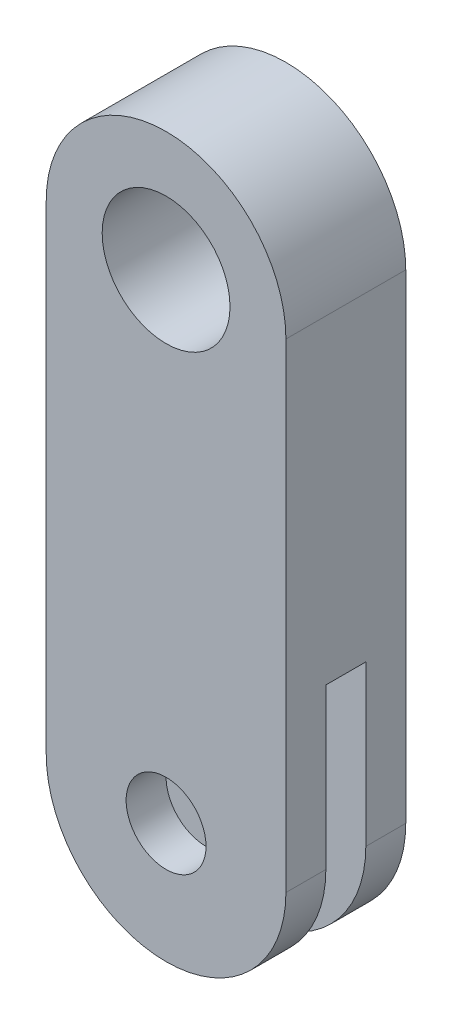
from build123d import *
from build123d.topology import SkipClean

# Parameters (mm, degrees)
SKETCH3_R           = 5
SKETCH3_R_2         = 8
BOSS_EXTRUDE1_DEPTH = 5
BOSS_EXTRUDE4_START = 5
SKETCH4_R           = 8
BOSS_EXTRUDE4_DEPTH = 5
BOSS_EXTRUDE5_START = 5
SKETCH5_R           = 8
SKETCH5_R_2         = 5
BOSS_EXTRUDE5_DEPTH = 5


with BuildPart() as part:
    # Sketch3 → Boss-Extrude1 (new body)
    with BuildSketch(Plane.XY):
        with BuildLine():
            Line((-29.334087167, 80.795829607), (-29.334087167, 20.795829607))
            ThreePointArc((-29.334087167, 20.795829607), (-14.334087167, 5.795829607), (0.665912833, 20.795829607))
            Line((0.665912833, 20.795829607), (0.665912833, 80.795829607))
            ThreePointArc((0.665912833, 80.795829607), (-14.334087167, 95.795829607), (-29.334087167, 80.795829607))
        make_face()
        with Locations((-14.334087167, 20.795829607)):
            Circle(SKETCH3_R, mode=Mode.SUBTRACT)
        with Locations((-14.334087167, 80.795829607)):
            Circle(SKETCH3_R_2, mode=Mode.SUBTRACT)
    extrude(amount=BOSS_EXTRUDE1_DEPTH)

    # Sketch4 → Boss-Extrude4 (add)
    with SkipClean():  # the faces are left unmerged after this step: merging them gives an invalid solid
        with BuildSketch(Plane(origin=(0, 0, 0), x_dir=(-1, 0, 0), z_dir=(0, 0, -1)).offset(BOSS_EXTRUDE4_START)):
            with BuildLine():
                Line((29.334087167, 80.795829607), (29.334087167, 40.795829607))
                Line((29.334087167, 40.795829607), (-0.665912833, 40.795829607))
                Line((-0.665912833, 40.795829607), (-0.665912833, 80.795829607))
                ThreePointArc((-0.665912833, 80.795829607), (14.334087167, 95.795829607), (29.334087167, 80.795829607))
            make_face()
            with Locations((14.334087167, 80.795829607)):
                Circle(SKETCH4_R, mode=Mode.SUBTRACT)
        extrude(amount=-BOSS_EXTRUDE4_DEPTH)

    # Sketch5 → Boss-Extrude5 (add)
    with SkipClean():  # the faces are left unmerged after this step: merging them gives an invalid solid
        with BuildSketch(Plane(origin=(0, 0, -5), x_dir=(-1, 0, 0), z_dir=(0, 0, -1)).offset(BOSS_EXTRUDE5_START)):
            with BuildLine():
                Line((29.334087167, 20.795829607), (29.334087167, 80.795829607))
                ThreePointArc((29.334087167, 80.795829607), (14.334087167, 95.795829607), (-0.665912833, 80.795829607))
                Line((-0.665912833, 80.795829607), (-0.665912833, 20.795829607))
                ThreePointArc((-0.665912833, 20.795829607), (14.334087167, 5.795829607), (29.334087167, 20.795829607))
            make_face()
            with Locations((14.334087167, 80.795829607)):
                Circle(SKETCH5_R, mode=Mode.SUBTRACT)
            with Locations(Location((14.334087167, 20.795829607, 0), (0, 0, 180))):
                Circle(SKETCH5_R_2, mode=Mode.SUBTRACT)
        extrude(amount=-BOSS_EXTRUDE5_DEPTH)


solid = part.part
